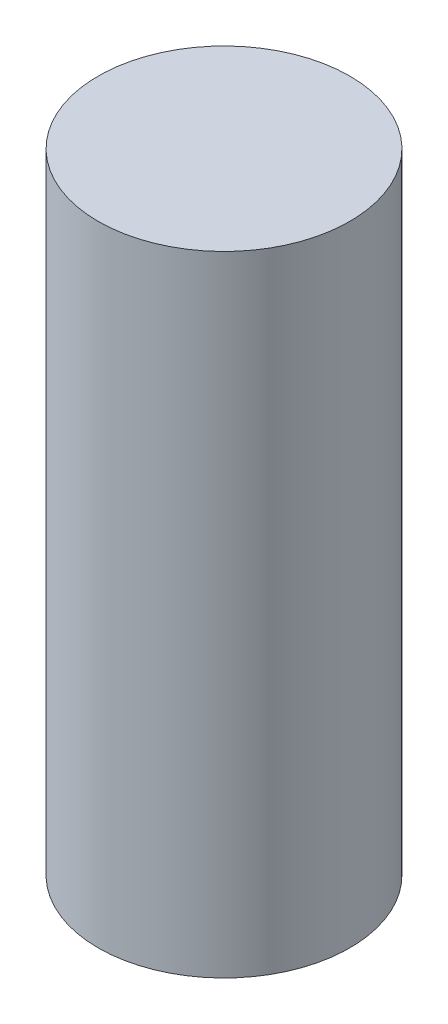
from build123d import *

# Parameters (mm, degrees)
SKETCH_1_R      = 2
EXTRUDE_1_DEPTH = 10


with BuildPart() as part:
    # 草图1 → 凸台-拉伸1 (new body)
    with BuildSketch(Plane(origin=(0, 0, 0), x_dir=(1, 0, 0), z_dir=(0, 1, 0))):
        with Locations(Location((0, 0, 0), (0, 0, 270))):
            Circle(SKETCH_1_R)
    extrude(amount=EXTRUDE_1_DEPTH)


solid = part.part
